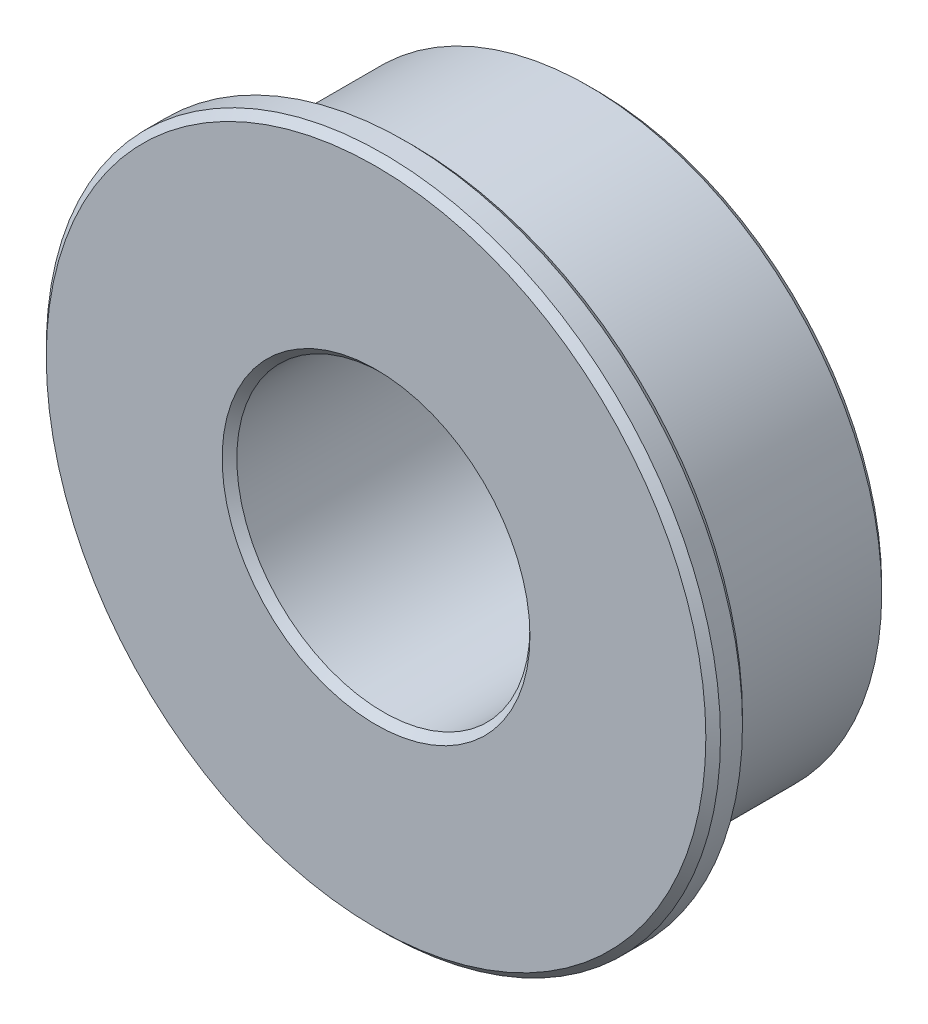
from build123d import *

# Parameters (mm, degrees)
SKETCH_1_R      = 4
SKETCH_1_R_2    = 2
EXTRUDE_1_DEPTH = 3
EXTRUDE_START   = -0.5
SKETCH_2_R      = 4.6
SKETCH_2_R_2    = 4
EXTRUDE_2_DEPTH = 0.5
CHAMFER_1_SIZE  = 0.1


with BuildPart() as part:
    # 草图1 → 凸台-拉伸1 (new body)
    with BuildSketch(Plane.XY):
        Circle(SKETCH_1_R)
        Circle(SKETCH_1_R_2, mode=Mode.SUBTRACT)
    extrude(amount=EXTRUDE_1_DEPTH)

    # 草图2 → 凸台-拉伸2 (add)
    with BuildSketch(Plane.XY.offset(3).offset(EXTRUDE_START)):
        Circle(SKETCH_2_R)
        Circle(SKETCH_2_R_2, mode=Mode.SUBTRACT)
    extrude(amount=EXTRUDE_2_DEPTH)

    # 倒角1
    chamfer_1_edges = [part.edges().sort_by_distance(p)[0] for p in [
        (-4.6, 0, 2.5),
        (-4.6, 0, 3),
        (-4, 0, 0),
        (-2, 0, 0),
        (-2, 0, 3),
    ]]
    chamfer(chamfer_1_edges, length=CHAMFER_1_SIZE)


solid = part.part
